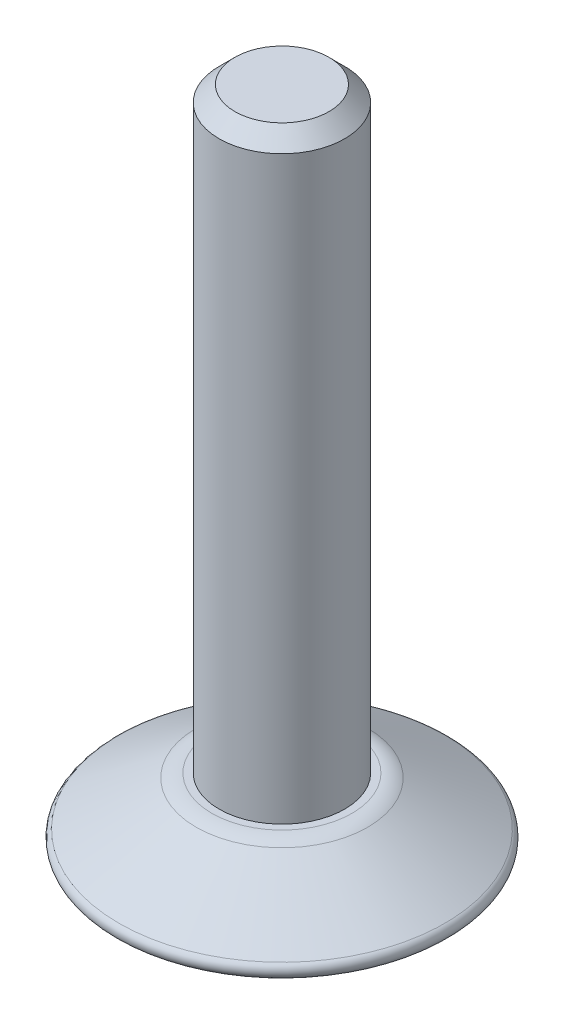
from build123d import *

# Parameters (mm, degrees)
SKETCH1_R               = 6
BOSS_EXTRUDE1_DEPTH     = 10
CHAMFER1_SIZE           = 3.5
CHAMFER1_SIZE2          = 2.020725942
CUT_EXTRUDE1_DEPTH      = 14.114877049
CUT_EXTRUDE1_DEPTH_BACK = 14.114877049
SKETCH2_W               = 12
SKETCH2_H               = 7.979274058
SKETCH3_R               = 2
BOSS_EXTRUDE2_DEPTH     = 19
CHAMFER2_SIZE           = 0.5
FILLET1_R               = 0.25
FILLET2_R               = 1


with BuildPart() as part:
    # Sketch1 → Boss-Extrude1 (new body)
    with BuildSketch(Plane(origin=(0, 0, 0), x_dir=(1, 0, 0), z_dir=(0, 1, 0))):
        with Locations(Location((0, 0, 0), (0, 0, 270))):
            Circle(SKETCH1_R)
    extrude(amount=BOSS_EXTRUDE1_DEPTH)

    # Chamfer1
    chamfer1_edges = [part.edges().sort_by_distance(p)[0] for p in [
        (0, 10, -6),
    ]]
    chamfer1_side = [part.faces().sort_by_distance(p)[0] for p in [
        (0, 10, 0),
    ]]
    chamfer(chamfer1_edges, length=CHAMFER1_SIZE, length2=CHAMFER1_SIZE2, reference=chamfer1_side[0])

    # Sketch2 → Cut-Extrude1 (cut, two sides: drawn at the far end of the back side and taken through both)
    with BuildSketch(Plane.XY.offset(-CUT_EXTRUDE1_DEPTH_BACK)):
        with Locations((0, 3.989637029)):
            Rectangle(SKETCH2_W, SKETCH2_H)
    extrude(amount=CUT_EXTRUDE1_DEPTH + CUT_EXTRUDE1_DEPTH_BACK, mode=Mode.SUBTRACT)

    # Sketch3 → Boss-Extrude2 (add)
    with BuildSketch(Plane(origin=(0, 10, 0), x_dir=(1, 0, 0), z_dir=(0, 1, 0))):
        with Locations(Location((0, 0, 0), (0, 0, 270))):
            Circle(SKETCH3_R)
    extrude(amount=BOSS_EXTRUDE2_DEPTH)

    # Chamfer2
    chamfer2_edges = [part.edges().sort_by_distance(p)[0] for p in [
        (0, 29, -2),
    ]]
    chamfer(chamfer2_edges, length=CHAMFER2_SIZE)

    # Fillet1
    fillet1_edges = [part.edges().sort_by_distance(p)[0] for p in [
        (0, 7.979274058, -6),
    ]]
    fillet(fillet1_edges, radius=FILLET1_R)

    # Fillet2
    fillet2_edges = [part.edges().sort_by_distance(p)[0] for p in [
        (0, 10, -2.5),
    ]]
    fillet(fillet2_edges, radius=FILLET2_R)


solid = part.part
